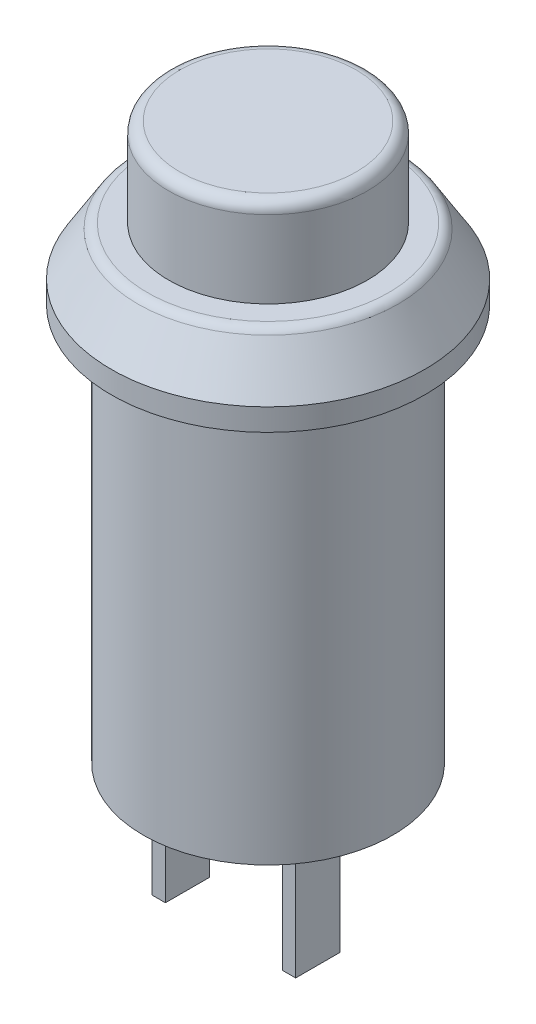
from build123d import *

# Parameters (mm, degrees)
FILLET1_R           = 0.5
SKETCH2_W           = 0.6
SKETCH2_H           = 2
BOSS_EXTRUDE1_DEPTH = 5.8


with BuildPart() as part:
    # Sketch1 → Revolve1 (revolve)
    with BuildSketch(Plane.XY, mode=Mode.PRIVATE) as revolve1_sk:
        Polygon((0, 0), (-5.65, 0), (-5.65, 18), (-7.1, 18), (-7.1, 19), (-5.75, 21.2), (-4.5, 21.2), (-4.5, 25.2), (0, 25.2), align=None)
    revolve(revolve1_sk.sketch.rotate(Axis((0, 0, 0), (0, 1, 0)), 270), axis=Axis((0, 0, 0), (0, 1, 0)))

    # Fillet1
    fillet1_edges = [part.edges().sort_by_distance(p)[0] for p in [
        (0, 25.2, 4.5),
        (0, 21.2, 5.75),
    ]]
    fillet(fillet1_edges, radius=FILLET1_R)

    # Sketch2 → Boss-Extrude1 (add)
    with BuildSketch(Plane.XZ):
        with Locations((-2.95, 1)):
            Rectangle(SKETCH2_W, SKETCH2_H)
        with Locations((2.95, 1)):
            Rectangle(SKETCH2_W, SKETCH2_H)
    extrude(amount=BOSS_EXTRUDE1_DEPTH)


solid = part.part
